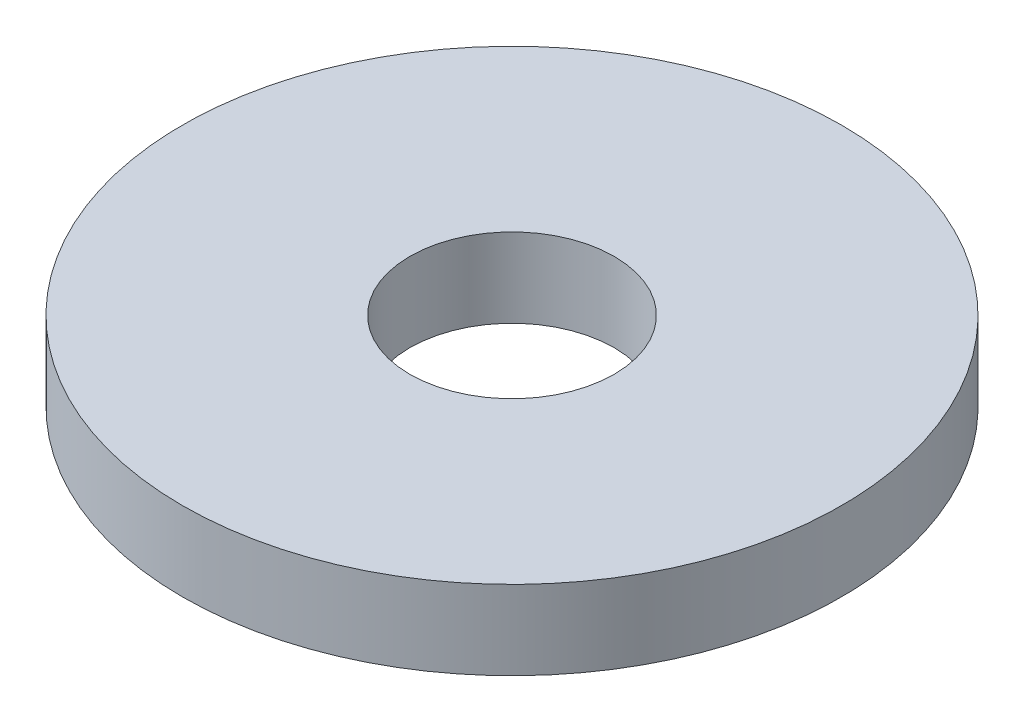
from build123d import *

# Parameters (mm, degrees)
SKETCH1_R           = 5
SKETCH1_R_2         = 1.55
BOSS_EXTRUDE1_DEPTH = 1.2


with BuildPart() as part:
    # Sketch1 → Boss-Extrude1 (new body)
    with BuildSketch(Plane(origin=(0, 0, 0), x_dir=(1, 0, 0), z_dir=(0, 1, 0))):
        with Locations(Location((0, 0, 0), (0, 0, 270))):
            Circle(SKETCH1_R)
        with Locations(Location((0, 0, 0), (0, 0, 270))):
            Circle(SKETCH1_R_2, mode=Mode.SUBTRACT)
    extrude(amount=BOSS_EXTRUDE1_DEPTH)


solid = part.part
